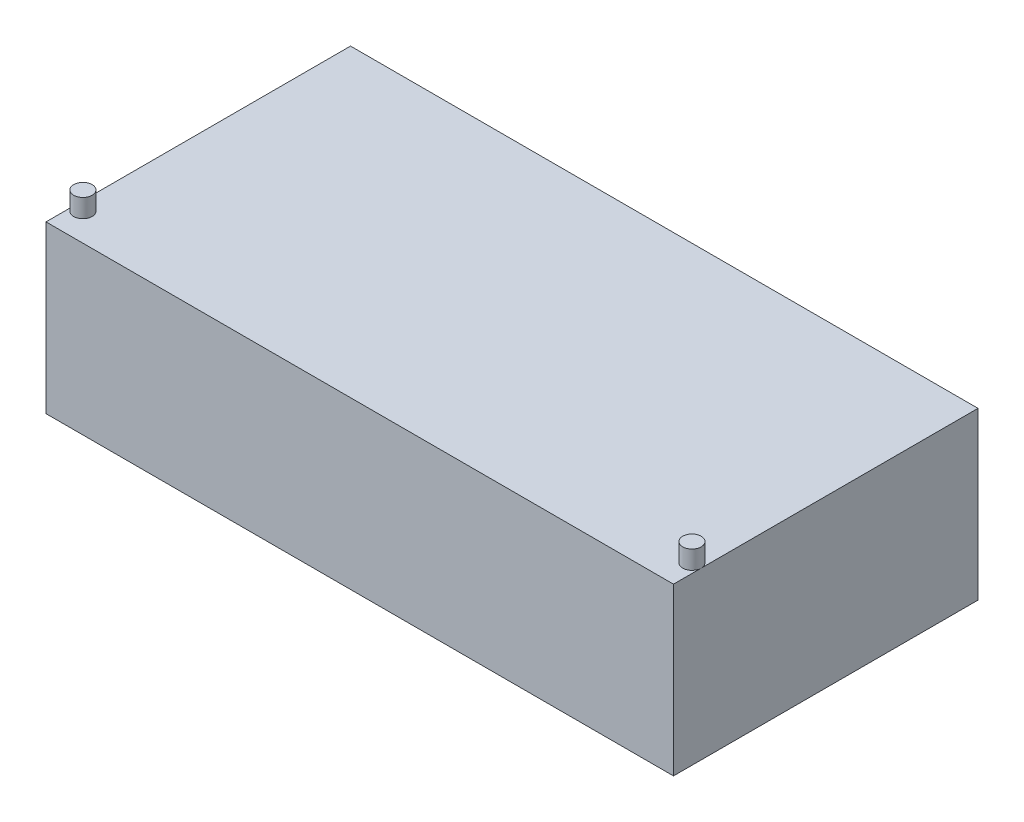
from build123d import *

# Parameters (mm, degrees)
SKETCH1_W           = 340
SKETCH1_H           = 165
BOSS_EXTRUDE1_DEPTH = 90
SKETCH2_R           = 5
BOSS_EXTRUDE2_DEPTH = 10


with BuildPart() as part:
    # Sketch1 → Boss-Extrude1 (new body)
    with BuildSketch(Plane(origin=(0, 0, 0), x_dir=(1, 0, 0), z_dir=(0, 1, 0))):
        Rectangle(SKETCH1_W, SKETCH1_H)
    extrude(amount=BOSS_EXTRUDE1_DEPTH)

    # Sketch2 → Boss-Extrude2 (add)
    with BuildSketch(Plane(origin=(0, 90, 0), x_dir=(1, 0, 0), z_dir=(0, 1, 0))):
        with Locations(Location((-165, -67.5, 0), (0, 0, 180))):
            Circle(SKETCH2_R)
        with Locations((165, -67.5)):
            Circle(SKETCH2_R)
    extrude(amount=BOSS_EXTRUDE2_DEPTH)


solid = part.part
